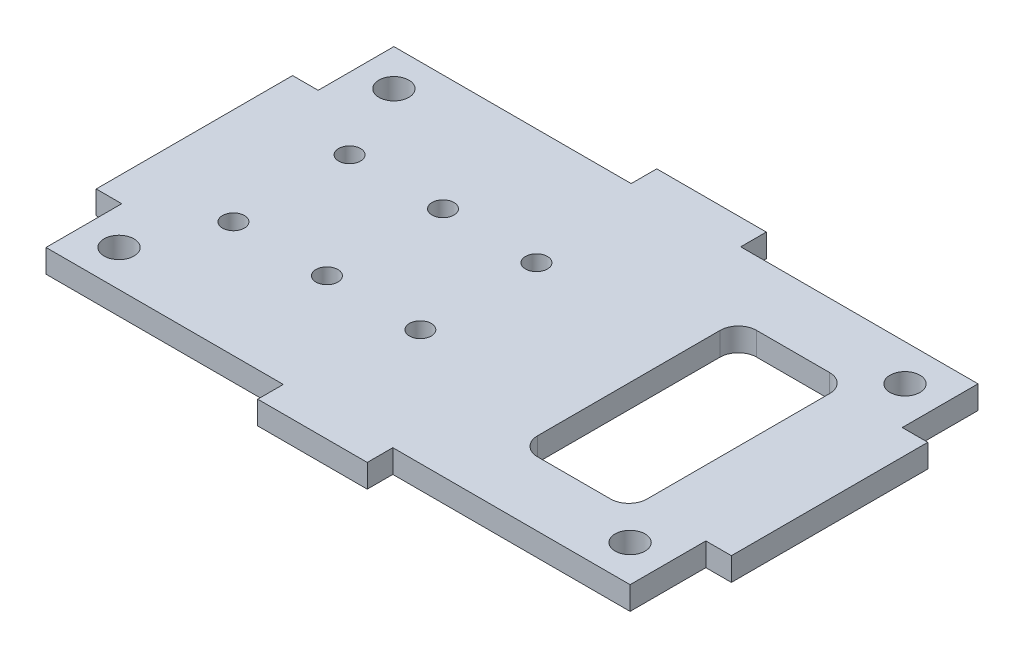
from build123d import *

# Parameters (mm, degrees)
SKETCH2_W               = 80
SKETCH2_H               = 47.65
BOSS_EXTRUDE1_DEPTH     = 3.175
SKETCH3_W               = 15
SKETCH3_H               = 3.5
BOSS_EXTRUDE2_DEPTH     = 3.175
SKETCH4_W               = 3.5
SKETCH4_H               = 26.9
BOSS_EXTRUDE3_DEPTH     = 3.175
SKETCH5_R               = 1.5
CUT_EXTRUDE1_DEPTH      = 20
LPATTERN1_COUNT         = 3
LPATTERN1_PITCH         = 12.8
MIRROR3_COPY_1_SKETCH_R = 1.5
MIRROR3_COPY_1_DEPTH    = 20
MIRROR3_COPY_2_SKETCH_R = 1.5
MIRROR3_COPY_2_DEPTH    = 20
SKETCH6_W               = 15
SKETCH6_H               = 30
CUT_EXTRUDE2_DEPTH      = 52.468303353
FILLET1_R               = 2.5
CUT_EXTRUDE3_DEPTH      = 52.468303353
CUT_EXTRUDE3_DEPTH_BACK = 52.468303353
SKETCH7_R               = 2.05


with BuildPart() as part:
    # Sketch2 → Boss-Extrude1 (new body)
    with BuildSketch(Plane(origin=(0, 0, 0), x_dir=(1, 0, 0), z_dir=(0, 1, 0))):
        Rectangle(SKETCH2_W, SKETCH2_H)
    extrude(amount=BOSS_EXTRUDE1_DEPTH)

    # Sketch3 → Boss-Extrude2 (add)
    with BuildSketch(Plane(origin=(0, 3.175, 0), x_dir=(1, 0, 0), z_dir=(0, 1, 0))):
        with Locations((0, 25.575)):
            Rectangle(SKETCH3_W, SKETCH3_H)
    boss_extrude2 = extrude(amount=-BOSS_EXTRUDE2_DEPTH)

    # Sketch4 → Boss-Extrude3 (add)
    with BuildSketch(Plane(origin=(0, 3.175, 0), x_dir=(1, 0, 0), z_dir=(0, 1, 0))):
        with Locations((-41.75, 0)):
            Rectangle(SKETCH4_W, SKETCH4_H)
    boss_extrude3 = extrude(amount=-BOSS_EXTRUDE3_DEPTH)

    # Mirror1: Boss-Extrude3 across plane
    add(boss_extrude3.mirror(Plane(origin=(0, 0, 0), x_dir=(0, 0, 1), z_dir=(1, 0, 0))))

    # Mirror2: Boss-Extrude2 across plane
    add(boss_extrude2.mirror(Plane.XY))

    # Sketch5 → Cut-Extrude1 (cut)
    with BuildSketch(Plane(origin=(0, 3.175, 0), x_dir=(1, 0, 0), z_dir=(0, 1, 0))):
        with Locations(Location((-30.2, 7.95, 0), (0, 0, 270))):
            Circle(SKETCH5_R)
    cut_extrude1 = extrude(amount=-CUT_EXTRUDE1_DEPTH, mode=Mode.SUBTRACT)

    # LPattern1: Cut-Extrude1 ×3
    with Locations(*[(i * LPATTERN1_PITCH, 0, 0) for i in range(1, LPATTERN1_COUNT)]):
        add(cut_extrude1, mode=Mode.SUBTRACT)

    # Mirror3: Cut-Extrude1 across plane
    add(cut_extrude1.mirror(Plane.XY), mode=Mode.SUBTRACT)

    # Mirror3 copy 1 sketch → Mirror3 copy 1 (cut)
    with BuildSketch(Plane(origin=(12.8, 3.175, 0), x_dir=(1, 0, 0), z_dir=(0, 1, 0))):
        with Locations((-30.2, -7.95)):
            Circle(MIRROR3_COPY_1_SKETCH_R)
    extrude(amount=-MIRROR3_COPY_1_DEPTH, mode=Mode.SUBTRACT)

    # Mirror3 copy 2 sketch → Mirror3 copy 2 (cut)
    with BuildSketch(Plane(origin=(25.6, 3.175, 0), x_dir=(1, 0, 0), z_dir=(0, 1, 0))):
        with Locations((-30.2, -7.95)):
            Circle(MIRROR3_COPY_2_SKETCH_R)
    extrude(amount=-MIRROR3_COPY_2_DEPTH, mode=Mode.SUBTRACT)

    # Sketch6 → Cut-Extrude2 (cut, through all)
    with BuildSketch(Plane(origin=(0, 3.175, 0), x_dir=(1, 0, 0), z_dir=(0, 1, 0))):
        with Locations((23.5, 0)):
            Rectangle(SKETCH6_W, SKETCH6_H)
    extrude(amount=-CUT_EXTRUDE2_DEPTH, mode=Mode.SUBTRACT)

    # Fillet1
    fillet1_edges = [part.edges().sort_by_distance(p)[0] for p in [
        (16, 1.5875, 15),
        (16, 1.5875, -15),
        (31, 1.5875, -15),
        (31, 1.5875, 15),
    ]]
    fillet(fillet1_edges, radius=FILLET1_R)

    # Sketch7 → Cut-Extrude3 (cut, two sides: drawn at the far end of the back side and taken through both)
    with BuildSketch(Plane(origin=(0, 3.175, 0), x_dir=(1, 0, 0), z_dir=(0, 1, 0)).offset(-CUT_EXTRUDE3_DEPTH_BACK)):
        with Locations(Location((-35, 18.825, 0), (0, 0, 270))):
            Circle(SKETCH7_R)
        with Locations(Location((35, 18.825, 0), (0, 0, 270))):
            Circle(SKETCH7_R)
        with Locations(Location((-35, -18.825, 0), (0, 0, 270))):
            Circle(SKETCH7_R)
        with Locations(Location((35, -18.825, 0), (0, 0, 270))):
            Circle(SKETCH7_R)
    extrude(amount=CUT_EXTRUDE3_DEPTH + CUT_EXTRUDE3_DEPTH_BACK, mode=Mode.SUBTRACT)


solid = part.part
